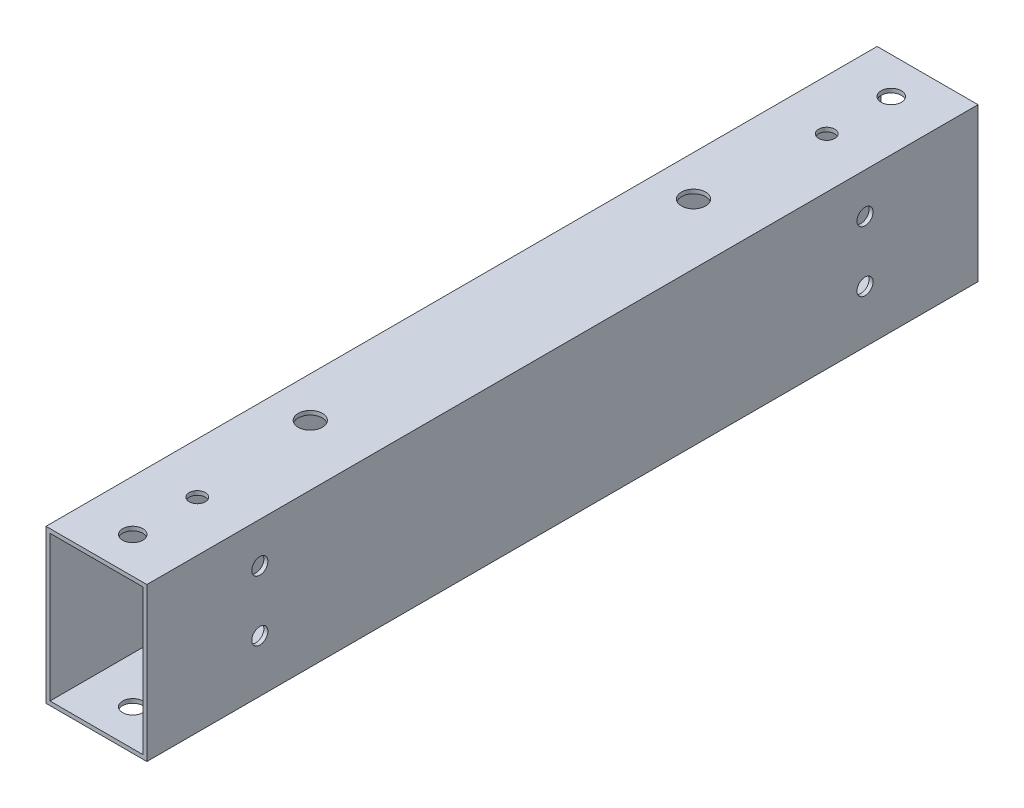
from build123d import *

# Parameters (mm, degrees)
SKETCH_1_W          = 25
SKETCH_1_H          = 38
SKETCH_1_W_2        = 23
SKETCH_1_H_2        = 36
EXTRUDE_1_DEPTH     = 103
SKETCH_2_R          = 2.5
SKETCH_2_R_2        = 2
CUT_EXTRUDE_1_DEPTH = 40
SKETCH_4_R          = 3
CUT_EXTRUDE_2_DEPTH = 38
SKETCH_5_R          = 2
CUT_EXTRUDE_3_DEPTH = 108.680081724


with BuildPart() as part:
    # 草图1 → 凸台-拉伸1 (new, symmetric)
    with BuildSketch(Plane.XY):
        Rectangle(SKETCH_1_W, SKETCH_1_H)
        Rectangle(SKETCH_1_W_2, SKETCH_1_H_2, mode=Mode.SUBTRACT)
    extrude(amount=EXTRUDE_1_DEPTH, both=True)

    # 草图2 → 切除-拉伸1 (cut)
    with BuildSketch(Plane(origin=(0, 19, 0), x_dir=(1, 0, 0), z_dir=(0, 1, 0))):
        with Locations(Location((0, 94, 0), (0, 0, 270))):
            Circle(SKETCH_2_R)
        with Locations(Location((0, 78, 0), (0, 0, 270))):
            Circle(SKETCH_2_R_2)
    cut_extrude_1 = extrude(amount=-CUT_EXTRUDE_1_DEPTH, mode=Mode.SUBTRACT)

    # 镜向1: 切除-拉伸1 across plane
    add(cut_extrude_1.mirror(Plane.XY), mode=Mode.SUBTRACT)

    # 草图4 → 切除-拉伸2 (cut)
    with BuildSketch(Plane(origin=(0, 19, 0), x_dir=(1, 0, 0), z_dir=(0, 1, 0))):
        with Locations(Location((-2.5, 47.5, 0), (0, 0, 270))):
            Circle(SKETCH_4_R)
        with Locations(Location((-2.5, -47.5, 0), (0, 0, 270))):
            Circle(SKETCH_4_R)
    extrude(amount=-CUT_EXTRUDE_2_DEPTH, mode=Mode.SUBTRACT)

    # 草图5 → 切除-拉伸3 (cut, through all)
    with BuildSketch(Plane(origin=(12.5, 0, 0), x_dir=(0, 0, -1), z_dir=(1, 0, 0))):
        with Locations(Location((-75, 9, 0), (0, 0, 90))):
            Circle(SKETCH_5_R)
        with Locations(Location((-75, -6, 0), (0, 0, 90))):
            Circle(SKETCH_5_R)
        with Locations(Location((75, -6, 0), (0, 0, 90))):
            Circle(SKETCH_5_R)
        with Locations(Location((75, 9, 0), (0, 0, 90))):
            Circle(SKETCH_5_R)
    extrude(amount=-CUT_EXTRUDE_3_DEPTH, mode=Mode.SUBTRACT)


solid = part.part
